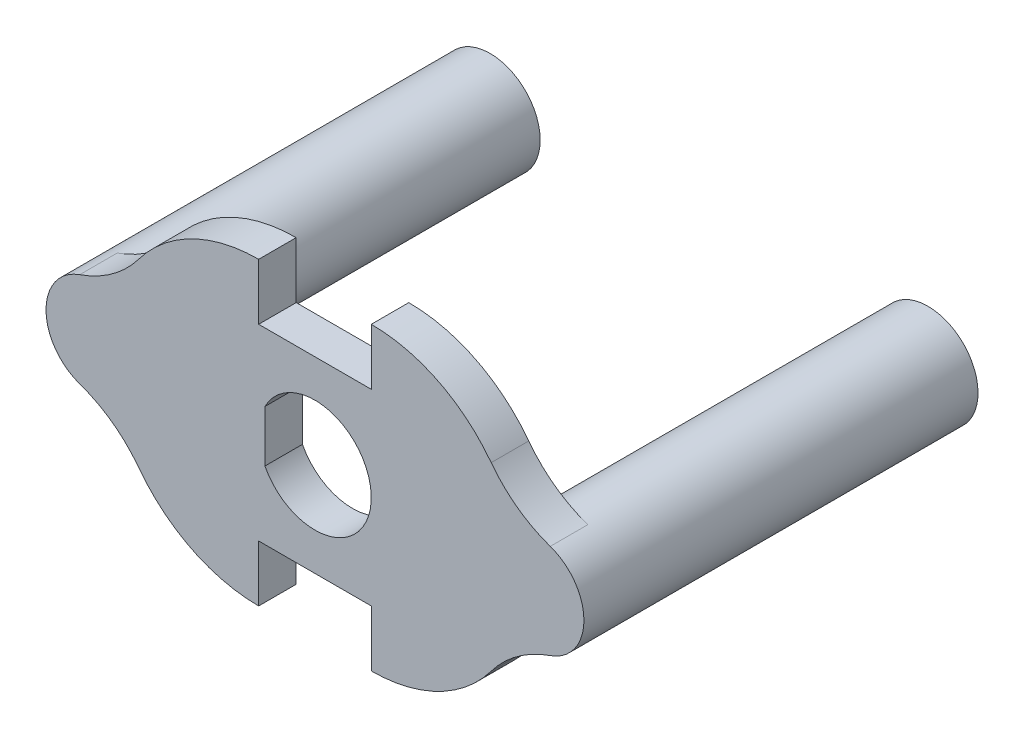
from build123d import *
from build123d.topology import SkipClean

# Parameters (mm, degrees)
EXTRUDE_1_DEPTH     = 1.5
CUT_EXTRUDE_1_DEPTH = 25.80423351
SKETCH_5_R          = 4
EXTRUDE_2_DEPTH     = 28.5
SKETCH_8_R          = 1.5
CUT_EXTRUDE_2_DEPTH = 10.5
CUT_EXTRUDE_3_DEPTH = 3
SKETCH_11_R         = 1.5
CUT_EXTRUDE_4_DEPTH = 5


with BuildPart() as part:
    # 草图1 → 凸台-拉伸1 (new, symmetric)
    with BuildSketch(Plane.XY):
        with BuildLine():
            Line((-4.5, 7.5), (4.5, 7.5))
            Line((4.5, 7.5), (4.5, 12))
            ThreePointArc((4.5, 12), (9.857189903, 10.7378078), (14.087412587, 7.216752724))
            ThreePointArc((14.087412587, 7.216752724), (16.191153731, 5.146301215), (18.807692308, 3.780203808))
            ThreePointArc((18.807692308, 3.780203808), (21.5, 0), (18.807692308, -3.780203808))
            ThreePointArc((18.807692308, -3.780203808), (16.191153731, -5.146301215), (14.087412587, -7.216752724))
            ThreePointArc((14.087412587, -7.216752724), (9.857189903, -10.7378078), (4.5, -12))
            Line((4.5, -12), (4.5, -7.5))
            Line((4.5, -7.5), (-4.5, -7.5))
            Line((-4.5, -7.5), (-4.5, -12))
            ThreePointArc((-4.5, -12), (-9.857189903, -10.7378078), (-14.087412587, -7.216752724))
            ThreePointArc((-14.087412587, -7.216752724), (-16.191153731, -5.146301215), (-18.807692308, -3.780203808))
            ThreePointArc((-18.807692308, -3.780203808), (-21.5, 0), (-18.807692308, 3.780203808))
            ThreePointArc((-18.807692308, 3.780203808), (-16.191153731, 5.146301215), (-14.087412587, 7.216752724))
            ThreePointArc((-14.087412587, 7.216752724), (-9.857189903, 10.7378078), (-4.5, 12))
            Line((-4.5, 12), (-4.5, 7.5))
        make_face()
    extrude(amount=EXTRUDE_1_DEPTH, both=True)

    # 草图4 → 切除-拉伸1 (cut, through all)
    with BuildSketch(Plane.XY.offset(1.5)):
        with BuildLine():
            Line((-4, 2.061552813), (-4, -2.061552813))
            ThreePointArc((-4, -2.061552813), (4.5, 0), (-4, 2.061552813))
        make_face()
    extrude(amount=-CUT_EXTRUDE_1_DEPTH, mode=Mode.SUBTRACT)

    # 草图5 → 凸台-拉伸2 (add)
    with BuildSketch(Plane(origin=(0, 0, -1.5), x_dir=(-1, 0, 0), z_dir=(0, 0, -1))):
        with Locations(Location((-17.5, 0, 0), (0, 0, 109.082124804))):
            Circle(SKETCH_5_R)
    extrude_2 = extrude(amount=EXTRUDE_2_DEPTH)

    # 草图8 → 切除-拉伸2 (cut)
    with BuildSketch(Plane(origin=(0, 0, -30), x_dir=(-1, 0, 0), z_dir=(0, 0, -1))):
        with Locations((-17.5, 0)):
            Circle(SKETCH_8_R)
    cut_extrude_2 = extrude(amount=-CUT_EXTRUDE_2_DEPTH, mode=Mode.SUBTRACT)

    # 镜向2: 凸台-拉伸2, 切除-拉伸2 across plane
    with SkipClean():  # the faces are left unmerged after this step: merging them gives an invalid solid
        add(extrude_2.mirror(Plane(origin=(0, 0, 0), x_dir=(0, 0, 1), z_dir=(1, 0, 0))))
        add(cut_extrude_2.mirror(Plane(origin=(0, 0, 0), x_dir=(0, 0, 1), z_dir=(1, 0, 0))), mode=Mode.SUBTRACT)

    # 草图10 → 切除-拉伸3 (cut, symmetric)
    with SkipClean():  # the faces are left unmerged after this step: merging them gives an invalid solid
        with BuildSketch(Plane(origin=(0, 0, -15.5), x_dir=(-1, 0, 0), z_dir=(0, 0, -1))):
            with BuildLine():
                Line((20.145751311, -3), (20.145751311, 3))
                ThreePointArc((20.145751311, 3), (21.5, 0), (20.145751311, -3))
            make_face()
        extrude(amount=CUT_EXTRUDE_3_DEPTH, both=True, mode=Mode.SUBTRACT)

    # 草图11 → 切除-拉伸4 (cut)
    with SkipClean():  # the faces are left unmerged after this step: merging them gives an invalid solid
        with BuildSketch(Plane.ZY.offset(20.145751311)):
            with Locations((-15.5, 0)):
                Circle(SKETCH_11_R)
        extrude(amount=-CUT_EXTRUDE_4_DEPTH, mode=Mode.SUBTRACT)


solid = part.part
